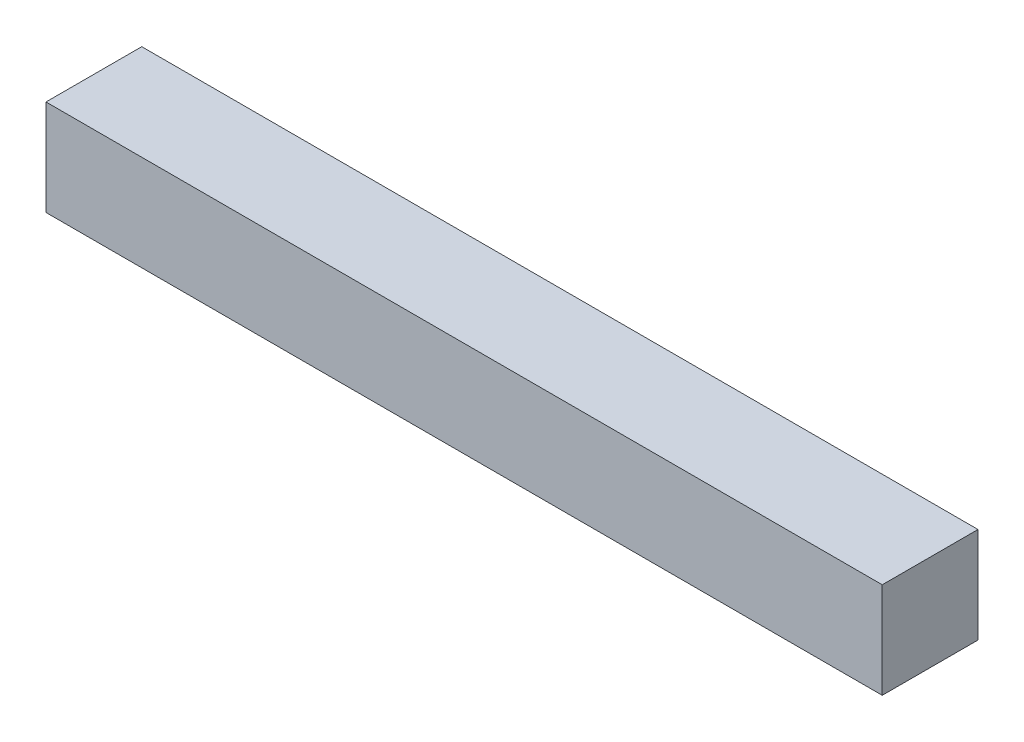
from build123d import *

# Parameters (mm, degrees)
SKETCH_1_W      = 262
SKETCH_1_H      = 30
EXTRUDE_1_DEPTH = 30


with BuildPart() as part:
    # 스케치1 → 보스-돌출1 (new body)
    with BuildSketch(Plane(origin=(0, 0, 0), x_dir=(1, 0, 0), z_dir=(0, 1, 0))):
        with Locations((131, 15)):
            Rectangle(SKETCH_1_W, SKETCH_1_H)
    extrude(amount=EXTRUDE_1_DEPTH)


solid = part.part
